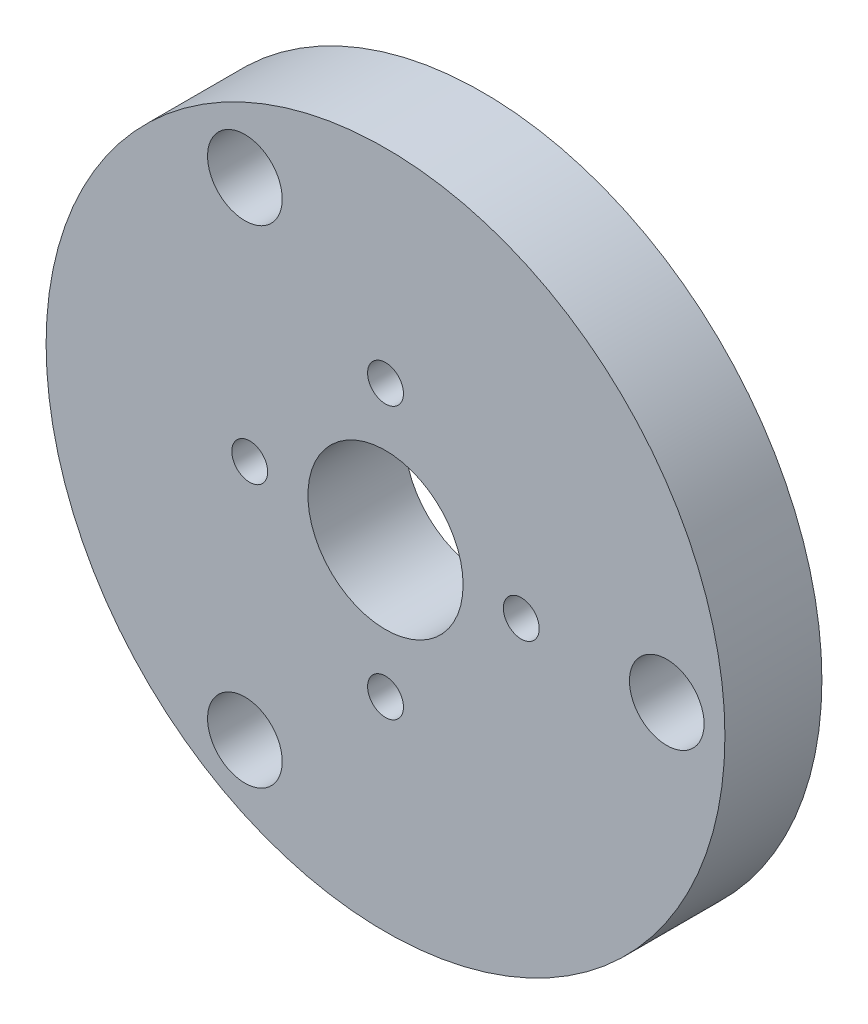
from build123d import *

# Parameters (mm, degrees)
ESQUISSE1_R        = 17.5
ESQUISSE1_R_2      = 0.925
ESQUISSE1_R_3      = 1.925
ESQUISSE1_R_4      = 4
BOSS_EXTRU_1_DEPTH = 5


with BuildPart() as part:
    # Esquisse1 → Boss.-Extru.1 (new body)
    with BuildSketch(Plane.XY):
        Circle(ESQUISSE1_R)
        with Locations((0, -7)):
            Circle(ESQUISSE1_R_2, mode=Mode.SUBTRACT)
        with Locations((-7, 0)):
            Circle(ESQUISSE1_R_2, mode=Mode.SUBTRACT)
        with Locations((0, 7)):
            Circle(ESQUISSE1_R_2, mode=Mode.SUBTRACT)
        with Locations((-7.25, -12.557368355)):
            Circle(ESQUISSE1_R_3, mode=Mode.SUBTRACT)
        with Locations((-7.25, 12.557368355)):
            Circle(ESQUISSE1_R_3, mode=Mode.SUBTRACT)
        Circle(ESQUISSE1_R_4, mode=Mode.SUBTRACT)
        with Locations((14.5, 0)):
            Circle(ESQUISSE1_R_3, mode=Mode.SUBTRACT)
        with Locations((7, 0)):
            Circle(ESQUISSE1_R_2, mode=Mode.SUBTRACT)
    extrude(amount=BOSS_EXTRU_1_DEPTH)


solid = part.part
